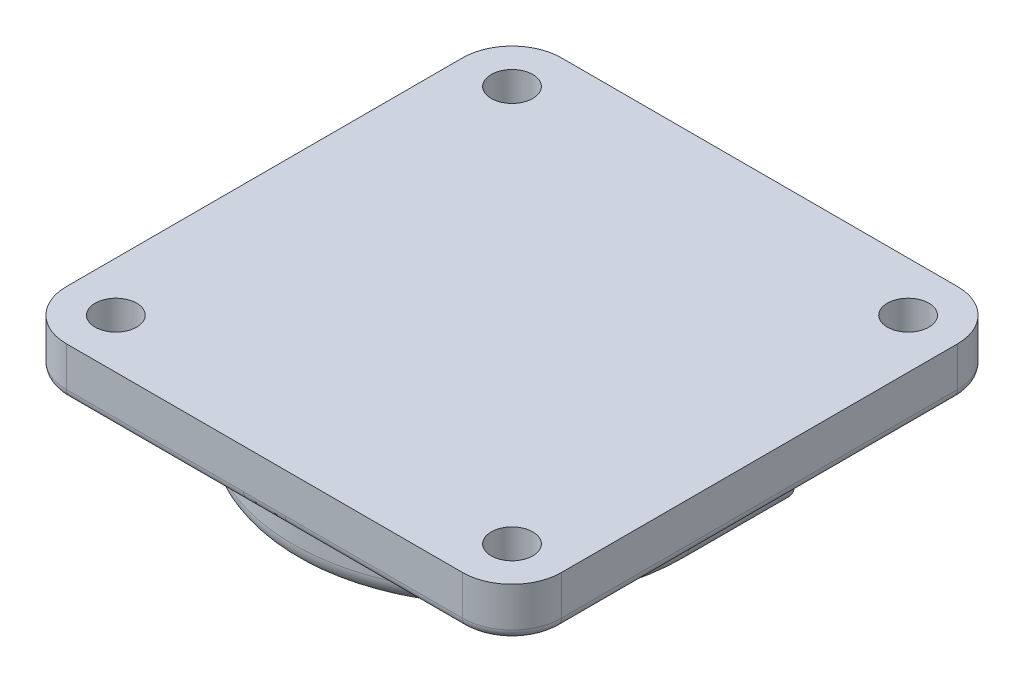
from build123d import *

# Parameters (mm, degrees)
BOSS_EXTRUDE1_DEPTH = 5
SKETCH1_3_R         = 2.1
CUT_EXTRUDE1_DEPTH  = 57.124860802
SKETCH1_4_R         = 2.1
CUT_EXTRUDE2_DEPTH  = 57.124860802
SKETCH1_5_R         = 2.1
CUT_EXTRUDE3_DEPTH  = 57.124860802
SKETCH1_6_R         = 2.1
CUT_EXTRUDE4_DEPTH  = 57.124860802
BOSS_EXTRUDE2_DEPTH = 6
FILLET1_R           = 2
FILLET2_R           = 2
FILLET3_R           = 2
FILLET4_R           = 2
FILLET5_R           = 1


with BuildPart() as part:
    # Sketch1 → Boss-Extrude1 (new body)
    with BuildSketch(Plane(origin=(0, 0, 0), x_dir=(1, 0, 0), z_dir=(0, 1, 0))):
        with BuildLine():
            Line((-20, 0), (20, 0))
            ThreePointArc((20, 0), (23.535533906, -1.464466094), (25, -5))
            Line((25, -5), (25, -45))
            ThreePointArc((25, -45), (23.535533906, -48.535533906), (20, -50))
            Line((20, -50), (-20, -50))
            ThreePointArc((-20, -50), (-23.535533906, -48.535533906), (-25, -45))
            Line((-25, -45), (-25, -5))
            ThreePointArc((-25, -5), (-23.535533906, -1.464466094), (-20, 0))
        make_face()
    extrude(amount=BOSS_EXTRUDE1_DEPTH)

    # Sketch1<3> → Cut-Extrude1 (cut, through all)
    with BuildSketch(Plane(origin=(0, 0, 0), x_dir=(1, 0, 0), z_dir=(0, 1, 0))):
        with Locations((20, -45)):
            Circle(SKETCH1_3_R)
    extrude(amount=CUT_EXTRUDE1_DEPTH, mode=Mode.SUBTRACT)

    # Sketch1<4> → Cut-Extrude2 (cut, through all)
    with BuildSketch(Plane(origin=(0, 0, 0), x_dir=(1, 0, 0), z_dir=(0, 1, 0))):
        with Locations((20, -5)):
            Circle(SKETCH1_4_R)
    extrude(amount=CUT_EXTRUDE2_DEPTH, mode=Mode.SUBTRACT)

    # Sketch1<5> → Cut-Extrude3 (cut, through all)
    with BuildSketch(Plane(origin=(0, 0, 0), x_dir=(1, 0, 0), z_dir=(0, 1, 0))):
        with Locations((-20, -5)):
            Circle(SKETCH1_5_R)
    extrude(amount=CUT_EXTRUDE3_DEPTH, mode=Mode.SUBTRACT)

    # Sketch1<6> → Cut-Extrude4 (cut, through all)
    with BuildSketch(Plane(origin=(0, 0, 0), x_dir=(1, 0, 0), z_dir=(0, 1, 0))):
        with Locations((-20, -45)):
            Circle(SKETCH1_6_R)
    extrude(amount=CUT_EXTRUDE4_DEPTH, mode=Mode.SUBTRACT)

    # Sketch1<8> → Boss-Extrude2 (add)
    with BuildSketch(Plane(origin=(0, 0, 0), x_dir=(1, 0, 0), z_dir=(0, 1, 0))):
        with BuildLine():
            Line((17.051994501, -27.070918511), (17.051994501, -16.496039026))
            Line((17.051994501, -16.496039026), (20.029081489, -16.496039026))
            Line((20.029081489, -16.496039026), (20.029081489, -27.070918511))
            ThreePointArc((20.029081489, -27.070918511), (0, -47.1), (-20.029081489, -27.070918511))
            Line((-20.029081489, -27.070918511), (-20.029081489, -16.496039026))
            Line((-20.029081489, -16.496039026), (-17.051994501, -16.496039026))
            Line((-17.051994501, -16.496039026), (-17.051994501, -27.070918511))
            ThreePointArc((-17.051994501, -27.070918511), (0, -44.122913013), (17.051994501, -27.070918511))
        make_face()
    extrude(amount=-BOSS_EXTRUDE2_DEPTH)

    # Fillet1
    fillet1_edges = [part.edges().sort_by_distance(p)[0] for p in [
        (-20.029081489, 0, 21.783478769),
        (20.029081489, 0, 21.783478769),
        (0, 0, 47.1),
    ]]
    fillet(fillet1_edges, radius=FILLET1_R)

    # Fillet2
    fillet2_edges = [part.edges().sort_by_distance(p)[0] for p in [
        (17.051994501, -3, 16.496039026),
    ]]
    fillet(fillet2_edges, radius=FILLET2_R)

    # Fillet3
    fillet3_edges = [part.edges().sort_by_distance(p)[0] for p in [
        (-17.051994501, -3, 16.496039026),
    ]]
    fillet(fillet3_edges, radius=FILLET3_R)

    # Fillet4
    fillet4_edges = [part.edges().sort_by_distance(p)[0] for p in [
        (-20.029081489, -6, 21.783478769),
        (0, -6, 47.1),
        (20.029081489, -6, 21.783478769),
    ]]
    fillet(fillet4_edges, radius=FILLET4_R)

    # Fillet5
    fillet5_edges = [part.edges().sort_by_distance(p)[0] for p in [
        (-23.535533906, 0, 1.464466094),
        (23.535533906, 0, 1.464466094),
        (25, 0, 25),
        (23.535533906, 0, 48.535533906),
        (0, 0, 50),
        (-23.535533906, 0, 48.535533906),
        (-25, 0, 25),
        (0, 0, 0),
    ]]
    fillet(fillet5_edges, radius=FILLET5_R)


solid = part.part
